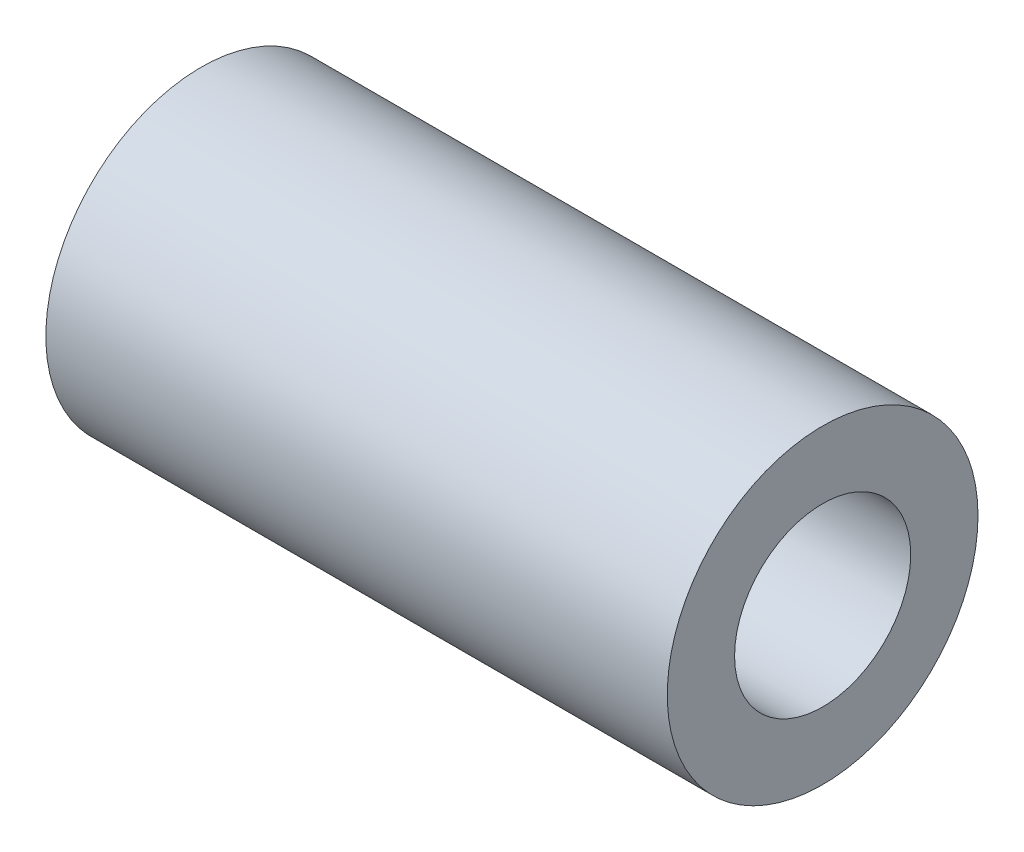
from build123d import *

# Parameters (mm, degrees)
SKETCH1_R           = 3.175
SKETCH1_R_2         = 1.8
BOSS_EXTRUDE1_DEPTH = 12.7


with BuildPart() as part:
    # Sketch1 → Boss-Extrude1 (new body)
    with BuildSketch(Plane(origin=(0, 0, 0), x_dir=(0, 0, -1), z_dir=(1, 0, 0))):
        Circle(SKETCH1_R)
        Circle(SKETCH1_R_2, mode=Mode.SUBTRACT)
    extrude(amount=BOSS_EXTRUDE1_DEPTH)


solid = part.part
